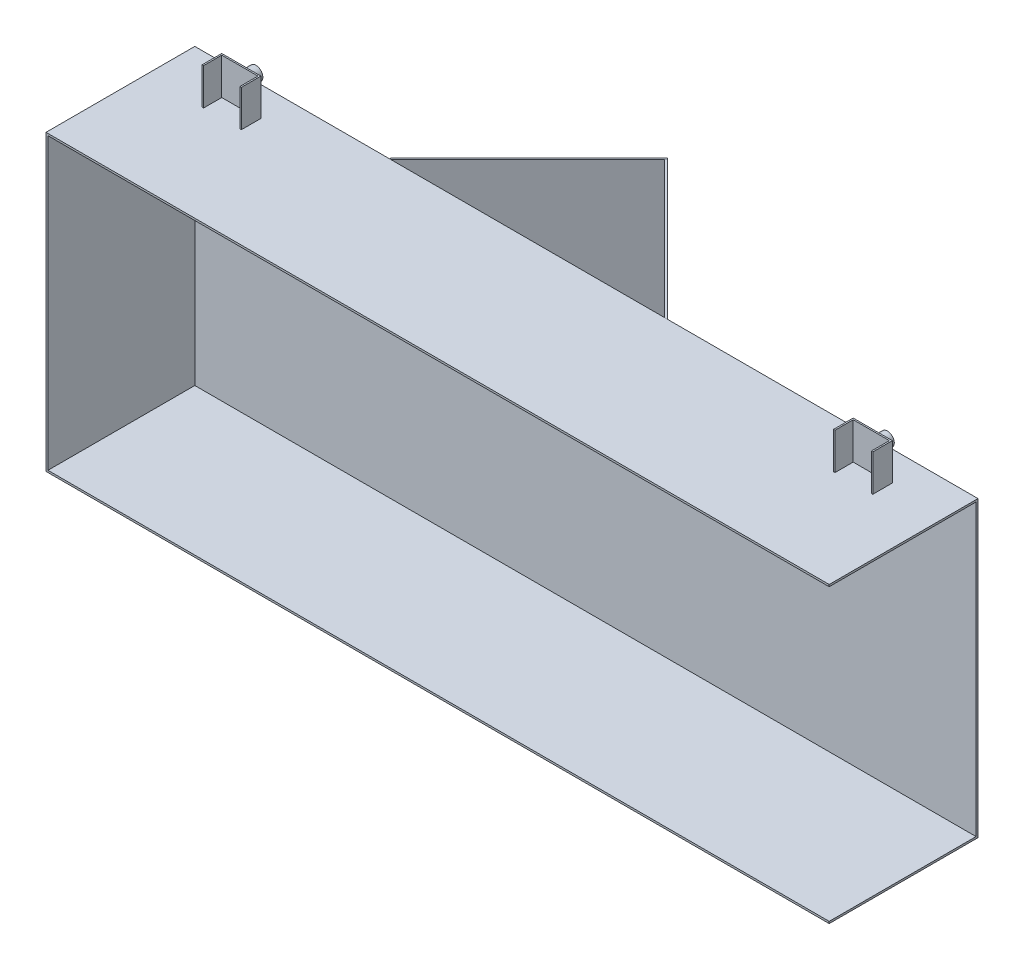
from build123d import *

# Parameters (mm, degrees)
SKETCH_1_W          = 1600
SKETCH_1_H          = 600
EXTRUDE_1_DEPTH     = 4
EXTRUDE_2_DEPTH     = 300
EXTRUDE_3_DEPTH     = 75
SKETCH_6_W          = 600
SKETCH_6_H          = 4
EXTRUDE_5_DEPTH     = 400
EXTRUDE_9_REACH     = 1182.949
SKETCH_7_W          = 4
SKETCH_7_H          = 600
SKETCH_4_R          = 14
EXTRUDE_10_DEPTH    = 30
SKETCH_8_R          = 7
CUT_EXTRUDE_1_DEPTH = 20


with BuildPart() as part:
    # 草图1 → 凸台-拉伸1 (new body)
    with BuildSketch(Plane.XY):
        Rectangle(SKETCH_1_W, SKETCH_1_H)
    extrude(amount=EXTRUDE_1_DEPTH)

    # 草图2 → 凸台-拉伸2 (add)
    with BuildSketch(Plane.XY.offset(4)):
        Polygon((796, 296), (-796, 296), (-796, -296), (796, -296), (800, -296), (800, -300), (-800, -300), (-800, 300), (800, 300), (800, 296), align=None)
    extrude(amount=EXTRUDE_2_DEPTH)

    # 草图3 → 凸台-拉伸3 (add)
    with BuildSketch(Plane.XZ.offset(300)):
        Polygon((685, 100), (685, 60), (605, 60), (605, 100), (608, 100), (608, 63), (682, 63), (682, 100), align=None)
        Polygon((-685, 100), (-685, 60), (-605, 60), (-605, 100), (-608, 100), (-608, 63), (-682, 63), (-682, 100), align=None)
    extrude_3 = extrude(amount=EXTRUDE_3_DEPTH)

    # 草图4 → 凸台-拉伸10 (add)
    with BuildSketch(Plane(origin=(0, 0, 60), x_dir=(-1, 0, 0), z_dir=(0, 0, -1))):
        with Locations(Location((-645, -343, 0), (0, 0, 180))):
            Circle(SKETCH_4_R)
        with Locations(Location((645, -345, 0), (0, 0, 180))):
            Circle(SKETCH_4_R)
    extrude_10 = extrude(amount=EXTRUDE_10_DEPTH)

    # 镜向3: 凸台-拉伸3, 凸台-拉伸10 across plane
    add(extrude_3.mirror(Plane.ZX))
    add(extrude_10.mirror(Plane.ZX))


with BuildPart() as body_2:
    # 草图6 → 凸台-拉伸5 (new body)
    with BuildSketch(Plane(origin=(-200, 0, 200), x_dir=(0, 1, 0), z_dir=(-0.7071067811865438, 0, 0.7071067811865512))):
        with Locations((0, 284.842712475)):
            Rectangle(SKETCH_6_W, SKETCH_6_H)
    extrude(amount=-EXTRUDE_5_DEPTH)

    # 草图8 → 切除-拉伸1 (cut)
    with BuildSketch(Plane(origin=(-202.828427125, 0, -202.828427125), x_dir=(-0.7071067811865438, 0, 0.7071067811865513), z_dir=(-0.7071067811865513, 0, -0.7071067811865438))):
        with Locations((127.842712475, 75)):
            Circle(SKETCH_8_R)
        with Locations((127.842712475, -75)):
            Circle(SKETCH_8_R)
        with Locations((37.842712475, -75)):
            Circle(SKETCH_8_R)
        with Locations((37.842712475, 75)):
            Circle(SKETCH_8_R)
    extrude(amount=-CUT_EXTRUDE_1_DEPTH, mode=Mode.SUBTRACT)


with BuildPart() as body_3:
    # 凸台-拉伸9: up to this plane
    extrude_9_end = Plane(origin=(0, 0, 0), z_dir=(0, 0, -1))
    # 草图7 → 凸台-拉伸9 (new, up to the surface)
    with BuildSketch(Plane(origin=(-200, 0, -200), x_dir=(0.7071067811865438, 0, -0.7071067811865513), z_dir=(0.7071067811865513, 0, 0.7071067811865438)), mode=Mode.PRIVATE) as extrude_9_sk1:
        with Locations((115.157287525, 0)):
            Rectangle(SKETCH_7_W, SKETCH_7_H)
    extrude_9_tool1 = split(extrude(extrude_9_sk1.sketch, amount=EXTRUDE_9_REACH, mode=Mode.PRIVATE), bisect_by=extrude_9_end, keep=Keep.BOTH, mode=Mode.PRIVATE)
    add(extrude_9_tool1.solids().sort_by_distance((-118.571501, 0, -281.428499))[0])


solid = Compound([part.part, body_2.part, body_3.part])
